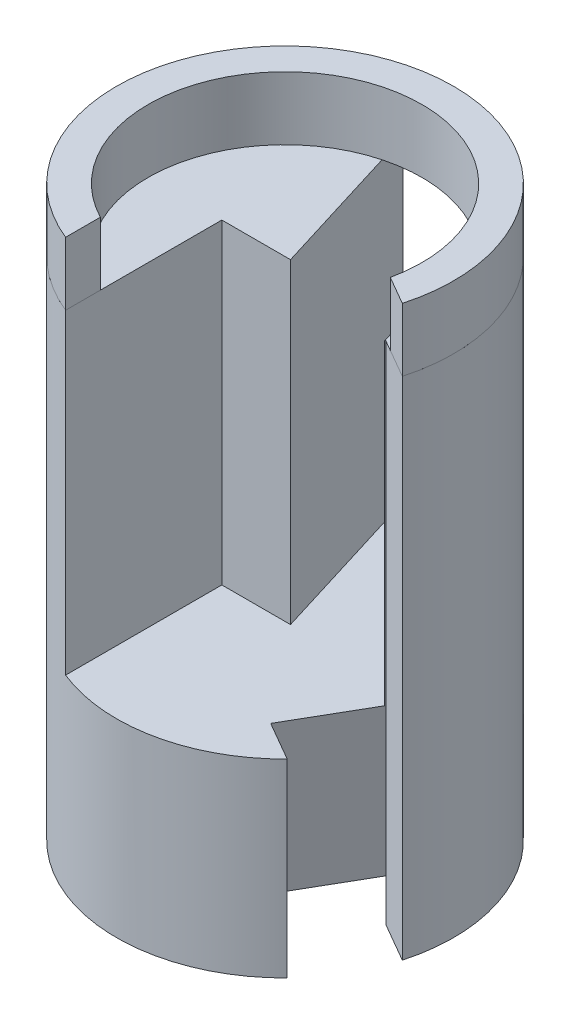
from build123d import *

# Parameters (mm, degrees)
SKETCH2_R           = 101.6
BOSS_EXTRUDE1_DEPTH = 304.8
SKETCH3_R           = 101.6
SKETCH3_R_2         = 82.55
BOSS_EXTRUDE2_DEPTH = 38.1
SKETCH4_W           = 76.2
SKETCH4_H           = 101.6
CUT_EXTRUDE1_DEPTH  = 228.6
CUT_EXTRUDE2_START  = -228.6
CUT_EXTRUDE2_DEPTH  = 190.5
SKETCH5_R           = 76.2
CUT_EXTRUDE3_DEPTH  = 25.4
CUT_EXTRUDE4_START  = -228.6
CUT_EXTRUDE4_DEPTH  = 228.6
CUT_EXTRUDE5_DEPTH  = 372.786941675


with BuildPart() as part:
    # Sketch2 → Boss-Extrude1 (new body)
    with BuildSketch(Plane(origin=(0, 0, 0), x_dir=(1, 0, 0), z_dir=(0, 1, 0))):
        with Locations(Location((0, 0, 0), (0, 0, 90))):
            Circle(SKETCH2_R)
    extrude(amount=BOSS_EXTRUDE1_DEPTH)


with BuildPart() as body_2:
    # Sketch3 → Boss-Extrude2 (new body)
    with BuildSketch(Plane(origin=(0, 304.8, 0), x_dir=(1, 0, 0), z_dir=(0, 1, 0))):
        with Locations(Location((0, 0, 0), (0, 0, 90))):
            Circle(SKETCH3_R)
        with Locations(Location((0, 0, 0), (0, 0, 90))):
            Circle(SKETCH3_R_2, mode=Mode.SUBTRACT)
    extrude(amount=BOSS_EXTRUDE2_DEPTH)


with BuildPart() as cut_extrude1_tool:
    # Sketch4 → Cut-Extrude1 (new body)
    with BuildSketch(Plane(origin=(0, 342.9, 0), x_dir=(1, 0, 0), z_dir=(0, 1, 0))):
        with Locations((0, -50.8)):
            Rectangle(SKETCH4_W, SKETCH4_H)
    extrude(amount=-CUT_EXTRUDE1_DEPTH)


with BuildPart() as part_1:
    add(part.part)

    # Cut-Extrude1: cut by cut_extrude1_tool
    add(cut_extrude1_tool.part, mode=Mode.SUBTRACT)

    # Sketch4<4> → Cut-Extrude2 (cut)
    with BuildSketch(Plane(origin=(0, 342.9, 0), x_dir=(1, 0, 0), z_dir=(0, 1, 0)).offset(CUT_EXTRUDE2_START)):
        with BuildLine():
            ThreePointArc((78.027556588, -26.94815231), (62.505565542, -53.92176533), (38.1, -73.231772476))
            Line((38.1, -73.231772476), (38.1, -94.185720786))
            ThreePointArc((38.1, -94.185720786), (65.394822961, -77.756524678), (86.259952515, -53.682218584))
            Line((86.259952515, -53.682218584), (78.027556588, -26.94815231))
        make_face()
        with BuildLine():
            Line((-21.27474203, 79.761443389), (3.286721048, 0))
            Line((3.286721048, 0), (38.1, 0))
            Line((38.1, 0), (38.1, -73.231772476))
            ThreePointArc((38.1, -73.231772476), (62.505565542, -53.92176533), (78.027556588, -26.94815231))
            Line((78.027556588, -26.94815231), (49.352145598, 66.173017347))
            ThreePointArc((49.352145598, 66.173017347), (15.596361061, 81.063284054), (-21.27474203, 79.761443389))
        make_face()
        with BuildLine():
            Line((-26.884440108, 97.978502132), (-21.27474203, 79.761443389))
            ThreePointArc((-21.27474203, 79.761443389), (15.596361061, 81.063284054), (49.352145598, 66.173017347))
            Line((49.352145598, 66.173017347), (41.119749671, 92.907083621))
            ThreePointArc((41.119749671, 92.907083621), (7.555847472, 101.318651634), (-26.884440108, 97.978502132))
        make_face()
    extrude(amount=CUT_EXTRUDE2_DEPTH, mode=Mode.SUBTRACT)

    # Sketch5 → Cut-Extrude3 (cut)
    with BuildSketch(Plane.XZ):
        with Locations(Location((0, 0, 0), (0, 0, 270))):
            Circle(SKETCH5_R)
    extrude(amount=-CUT_EXTRUDE3_DEPTH, mode=Mode.SUBTRACT)


with BuildPart() as body_2_1:
    add(body_2.part)

    # Cut-Extrude1: cut by cut_extrude1_tool
    add(cut_extrude1_tool.part, mode=Mode.SUBTRACT)


with BuildPart() as cut_extrude4_tool:
    # Sketch6 → Cut-Extrude4 (new body)
    with BuildSketch(Plane(origin=(0, 342.9, 0), x_dir=(1, 0, 0), z_dir=(0, 1, 0)).offset(CUT_EXTRUDE4_START)):
        Polygon((48.891726717, -57.557045256), (74.291726717, -13.562954744), (107.287294601, -32.612954744), (60.297294601, -114.002022192), (14.155449479, -87.362015489), (35.745449479, -49.967038554), align=None)
    extrude(amount=CUT_EXTRUDE4_DEPTH)


with BuildPart() as part_2:
    add(part_1.part)

    # Cut-Extrude4: cut by cut_extrude4_tool
    add(cut_extrude4_tool.part, mode=Mode.SUBTRACT)

    # Sketch6<4> → Cut-Extrude5 (cut, through all)
    with BuildSketch(Plane(origin=(0, 342.9, 0), x_dir=(1, 0, 0), z_dir=(0, 1, 0))):
        with BuildLine():
            ThreePointArc((97.894189943, -27.189843241), (87.988181024, -50.8), (72.494189943, -71.183933753))
            Line((72.494189943, -71.183933753), (81.887294601, -76.607045256))
            Line((81.887294601, -76.607045256), (107.287294601, -32.612954744))
            Line((107.287294601, -32.612954744), (97.894189943, -27.189843241))
        make_face()
        with BuildLine():
            ThreePointArc((80.722105782, -17.275535828), (71.490397082, -41.275), (55.322105782, -61.26962634))
            Line((55.322105782, -61.26962634), (72.494189943, -71.183933753))
            ThreePointArc((72.494189943, -71.183933753), (87.988181024, -50.8), (97.894189943, -27.189843241))
            Line((97.894189943, -27.189843241), (80.722105782, -17.275535828))
        make_face()
        with BuildLine():
            Line((74.291726717, -13.562954744), (48.891726717, -57.557045256))
            Line((48.891726717, -57.557045256), (55.322105782, -61.26962634))
            ThreePointArc((55.322105782, -61.26962634), (71.490397082, -41.275), (80.722105782, -17.275535828))
            Line((80.722105782, -17.275535828), (74.291726717, -13.562954744))
        make_face()
    extrude(amount=-CUT_EXTRUDE5_DEPTH, mode=Mode.SUBTRACT)


with BuildPart() as body_2_2:
    add(body_2_1.part)

    # Cut-Extrude4: cut by cut_extrude4_tool
    add(cut_extrude4_tool.part, mode=Mode.SUBTRACT)


solid = Compound([part_2.part, body_2_2.part])
